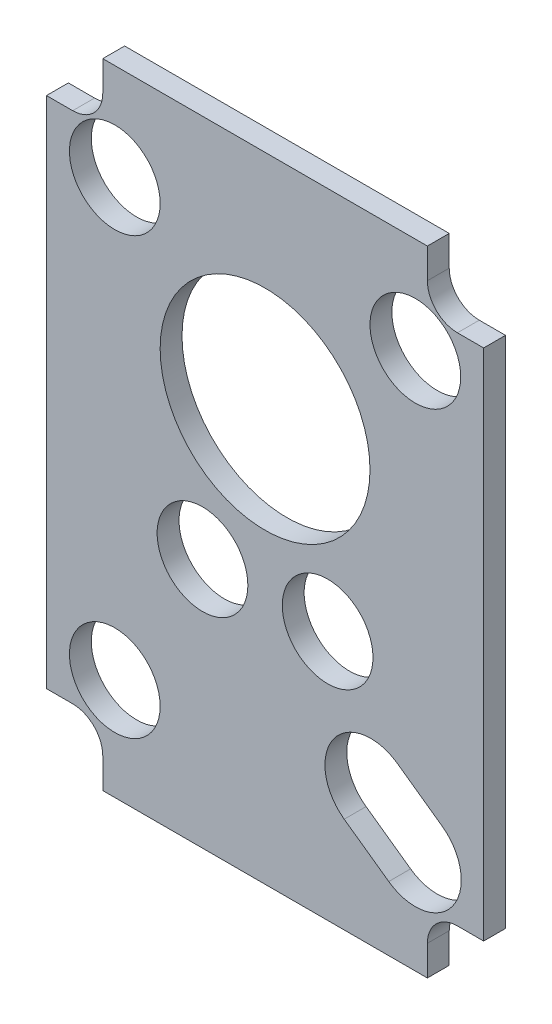
from build123d import *

# Parameters (mm, degrees)
SKETCH1_R           = 4.15
SKETCH1_R_2         = 9.6
BOSS_EXTRUDE1_DEPTH = 2


with BuildPart() as part:
    # Sketch1 → Boss-Extrude1 (new body)
    with BuildSketch(Plane.XY):
        with BuildLine():
            Line((-14.85, 29), (-14.85, 26.25))
            ThreePointArc((-14.85, 26.25), (-15.655456352, 24.305456352), (-17.6, 23.5))
            Line((-17.6, 23.5), (-20, 23.5))
            Line((-20, 23.5), (-20, -23.5))
            Line((-20, -23.5), (-17.6, -23.5))
            ThreePointArc((-17.6, -23.5), (-15.655456352, -24.305456352), (-14.85, -26.25))
            Line((-14.85, -26.25), (-14.85, -29))
            Line((-14.85, -29), (14.85, -29))
            Line((14.85, -29), (14.85, -26.25))
            ThreePointArc((14.85, -26.25), (15.655456352, -24.305456352), (17.6, -23.5))
            Line((17.6, -23.5), (20, -23.5))
            Line((20, -23.5), (20, 23.5))
            Line((20, 23.5), (17.6, 23.5))
            ThreePointArc((17.6, 23.5), (15.655456352, 24.305456352), (14.85, 26.25))
            Line((14.85, 26.25), (14.85, 29))
            Line((14.85, 29), (-14.85, 29))
        make_face()
        with Locations((-13.75, -19.7)):
            Circle(SKETCH1_R, mode=Mode.SUBTRACT)
        with Locations((-5.725, -6.1)):
            Circle(SKETCH1_R, mode=Mode.SUBTRACT)
        with BuildLine():
            ThreePointArc((16.186, -16.278610808), (17.171389192, -22.136), (11.314, -23.121389192))
            Line((11.314, -23.121389192), (7.240917629, -20.221389192))
            ThreePointArc((7.240917629, -20.221389192), (6.255528438, -14.364), (12.112917629, -13.378610808))
            Line((12.112917629, -13.378610808), (16.186, -16.278610808))
        make_face(mode=Mode.SUBTRACT)
        with Locations((5.725, -6.1)):
            Circle(SKETCH1_R, mode=Mode.SUBTRACT)
        with Locations((0, 8.65)):
            Circle(SKETCH1_R_2, mode=Mode.SUBTRACT)
        with Locations((-13.75, 20.15)):
            Circle(SKETCH1_R, mode=Mode.SUBTRACT)
        with Locations((13.75, 20.15)):
            Circle(SKETCH1_R, mode=Mode.SUBTRACT)
    extrude(amount=BOSS_EXTRUDE1_DEPTH)


solid = part.part
